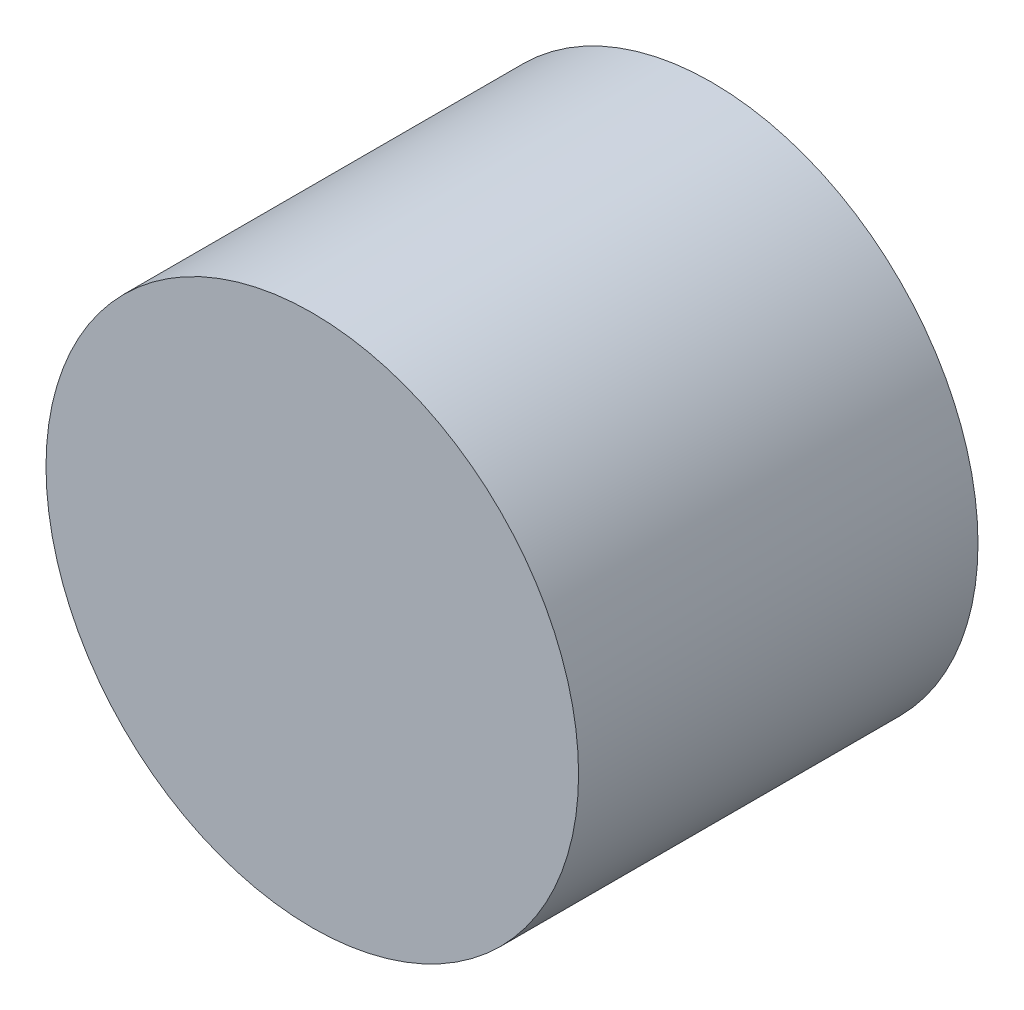
from build123d import *

# Parameters (mm, degrees)
SKETCH1_R           = 40
BOSS_EXTRUDE1_DEPTH = 60


with BuildPart() as part:
    # Sketch1 → Boss-Extrude1 (new body)
    with BuildSketch(Plane.XY):
        Circle(SKETCH1_R)
    extrude(amount=BOSS_EXTRUDE1_DEPTH)


solid = part.part
